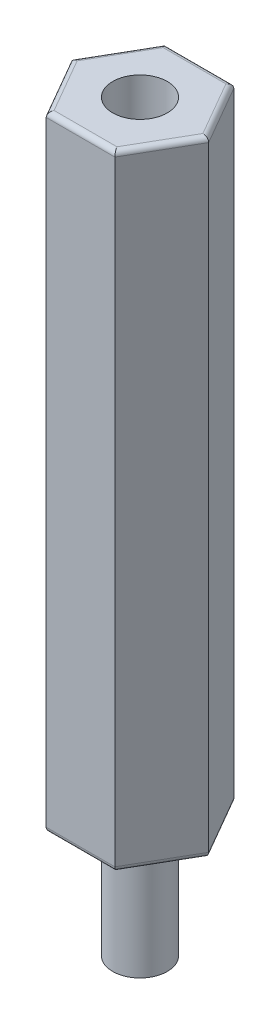
from build123d import *

# Parameters (mm, degrees)
RESSALTO_EXTRUS_O1_DEPTH = 25
FILETE1_R                = 0.2
ESBO_O2_R                = 1.0922
RESSALTO_EXTRUS_O2_DEPTH = 4.76
ESBO_O3_R                = 1.0922
CORTE_EXTRUS_O1_DEPTH    = 4.76


with BuildPart() as part:
    # Esboço1 → Ressalto-extrusão1 (new body)
    with BuildSketch(Plane(origin=(0, 0, 0), x_dir=(1, 0, 0), z_dir=(0, 1, 0))):
        Polygon((2.748187281, 0), (1.374093641, 2.38), (-1.374093641, 2.38), (-2.748187281, 0), (-1.374093641, -2.38), (1.374093641, -2.38), align=None)
    extrude(amount=RESSALTO_EXTRUS_O1_DEPTH)

    # Filete1
    filete1_edges = [part.edges().sort_by_distance(p)[0] for p in [
        (0, 25, -2.38),
        (-2.061140461, 25, -1.19),
        (-2.061140461, 25, 1.19),
        (0, 25, 2.38),
        (2.061140461, 25, 1.19),
        (0, 0, 2.38),
        (-2.061140461, 0, 1.19),
        (-2.061140461, 0, -1.19),
        (2.061140461, 25, -1.19),
        (0, 0, -2.38),
        (2.061140461, 0, -1.19),
        (2.061140461, 0, 1.19),
    ]]
    fillet(filete1_edges, radius=FILETE1_R)

    # Esboço2 → Ressalto-extrusão2 (add)
    with BuildSketch(Plane.XZ):
        with Locations(Location((0, 0, 0), (0, 0, 90))):
            Circle(ESBO_O2_R)
    extrude(amount=RESSALTO_EXTRUS_O2_DEPTH)

    # Esboço3 → Corte-extrusão1 (cut)
    with BuildSketch(Plane(origin=(0, 25, 0), x_dir=(1, 0, 0), z_dir=(0, 1, 0))):
        with Locations(Location((0, 0, 0), (0, 0, 270))):
            Circle(ESBO_O3_R)
    extrude(amount=-CORTE_EXTRUS_O1_DEPTH, mode=Mode.SUBTRACT)


solid = part.part
